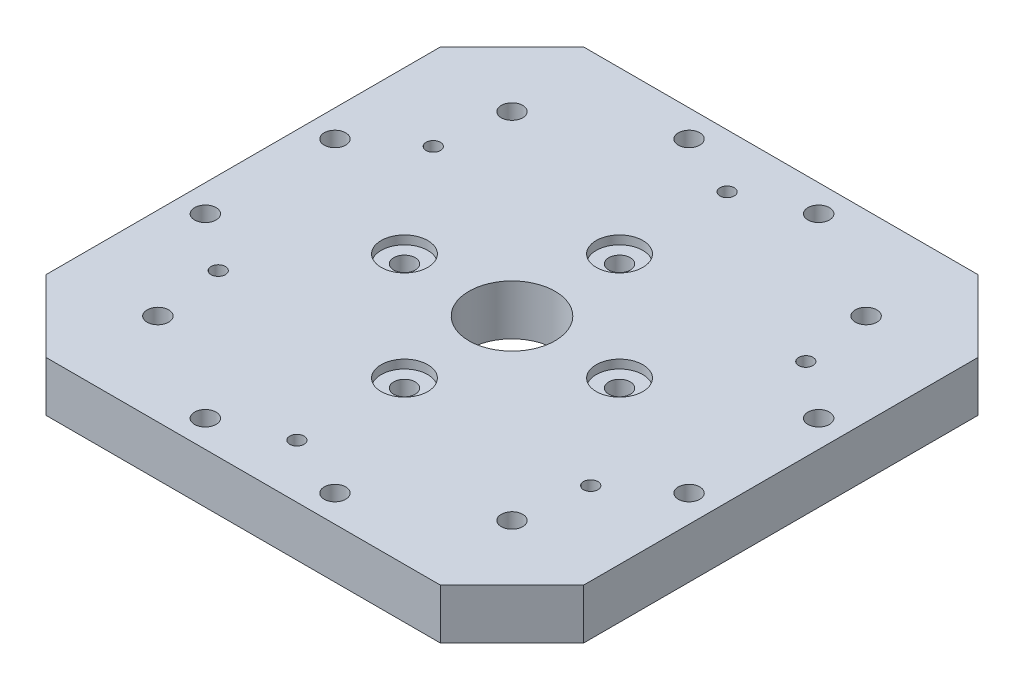
from build123d import *

# Parameters (mm, degrees)
SKETCH1_W           = 75
SKETCH1_H           = 75
SKETCH1_R           = 6
SKETCH1_R_2         = 1.5
SKETCH1_R_3         = 1
BOSS_EXTRUDE1_DEPTH = 7
SKETCH2_R           = 3.25
CUT_EXTRUDE1_DEPTH  = 1.2
CHAMFER1_SIZE       = 10


with BuildPart() as part:
    # Sketch1 → Boss-Extrude1 (new body)
    with BuildSketch(Plane(origin=(0, 0, 0), x_dir=(1, 0, 0), z_dir=(0, 1, 0))):
        Rectangle(SKETCH1_W, SKETCH1_H)
        with Locations(Location((0, 0, 0), (0, 0, 270))):
            Circle(SKETCH1_R, mode=Mode.SUBTRACT)
        with Locations(Location((0, 15, 0), (0, 0, 270))):
            Circle(SKETCH1_R_2, mode=Mode.SUBTRACT)
        with Locations(Location((15, 0, 0), (0, 0, 270))):
            Circle(SKETCH1_R_2, mode=Mode.SUBTRACT)
        with Locations(Location((0, -15, 0), (0, 0, 270))):
            Circle(SKETCH1_R_2, mode=Mode.SUBTRACT)
        with Locations(Location((-15, 0, 0), (0, 0, 270))):
            Circle(SKETCH1_R_2, mode=Mode.SUBTRACT)
        with Locations(Location((-33.737040436, -9.03981274, 0), (0, 0, 270))):
            Circle(SKETCH1_R_2, mode=Mode.SUBTRACT)
        with Locations(Location((-33.737040436, 9.03981274, 0), (0, 0, 270))):
            Circle(SKETCH1_R_2, mode=Mode.SUBTRACT)
        with Locations(Location((-24.697227696, 24.697227696, 0), (0, 0, 270))):
            Circle(SKETCH1_R_2, mode=Mode.SUBTRACT)
        with Locations(Location((-9.03981274, 33.737040436, 0), (0, 0, 270))):
            Circle(SKETCH1_R_2, mode=Mode.SUBTRACT)
        with Locations(Location((9.03981274, 33.737040436, 0), (0, 0, 270))):
            Circle(SKETCH1_R_2, mode=Mode.SUBTRACT)
        with Locations(Location((24.697227696, 24.697227696, 0), (0, 0, 270))):
            Circle(SKETCH1_R_2, mode=Mode.SUBTRACT)
        with Locations(Location((33.737040436, 9.03981274, 0), (0, 0, 270))):
            Circle(SKETCH1_R_2, mode=Mode.SUBTRACT)
        with Locations(Location((33.737040436, -9.03981274, 0), (0, 0, 270))):
            Circle(SKETCH1_R_2, mode=Mode.SUBTRACT)
        with Locations(Location((24.697227696, -24.697227696, 0), (0, 0, 270))):
            Circle(SKETCH1_R_2, mode=Mode.SUBTRACT)
        with Locations(Location((9.03981274, -33.737040436, 0), (0, 0, 270))):
            Circle(SKETCH1_R_2, mode=Mode.SUBTRACT)
        with Locations(Location((-9.03981274, -33.737040436, 0), (0, 0, 270))):
            Circle(SKETCH1_R_2, mode=Mode.SUBTRACT)
        with Locations(Location((-24.697227696, -24.697227696, 0), (0, 0, 270))):
            Circle(SKETCH1_R_2, mode=Mode.SUBTRACT)
        with Locations(Location((0, 30, 0), (0, 0, 270))):
            Circle(SKETCH1_R_3, mode=Mode.SUBTRACT)
        with Locations(Location((25.980762114, 15, 0), (0, 0, 270))):
            Circle(SKETCH1_R_3, mode=Mode.SUBTRACT)
        with Locations(Location((25.980762114, -15, 0), (0, 0, 270))):
            Circle(SKETCH1_R_3, mode=Mode.SUBTRACT)
        with Locations(Location((0, -30, 0), (0, 0, 270))):
            Circle(SKETCH1_R_3, mode=Mode.SUBTRACT)
        with Locations(Location((-25.980762114, -15, 0), (0, 0, 270))):
            Circle(SKETCH1_R_3, mode=Mode.SUBTRACT)
        with Locations(Location((-25.980762114, 15, 0), (0, 0, 270))):
            Circle(SKETCH1_R_3, mode=Mode.SUBTRACT)
    extrude(amount=BOSS_EXTRUDE1_DEPTH)

    # Sketch2 → Cut-Extrude1 (cut)
    with BuildSketch(Plane(origin=(0, 7, 0), x_dir=(1, 0, 0), z_dir=(0, 1, 0))):
        with Locations(Location((0, 15, 0), (0, 0, 270))):
            Circle(SKETCH2_R)
        with Locations(Location((15, 0, 0), (0, 0, 270))):
            Circle(SKETCH2_R)
        with Locations(Location((0, -15, 0), (0, 0, 270))):
            Circle(SKETCH2_R)
        with Locations(Location((-15, 0, 0), (0, 0, 270))):
            Circle(SKETCH2_R)
    extrude(amount=-CUT_EXTRUDE1_DEPTH, mode=Mode.SUBTRACT)

    # Chamfer1
    chamfer1_edges = [part.edges().sort_by_distance(p)[0] for p in [
        (-37.5, 3.5, -37.5),
        (37.5, 3.5, -37.5),
        (37.5, 3.5, 37.5),
        (-37.5, 3.5, 37.5),
    ]]
    chamfer(chamfer1_edges, length=CHAMFER1_SIZE)


solid = part.part
